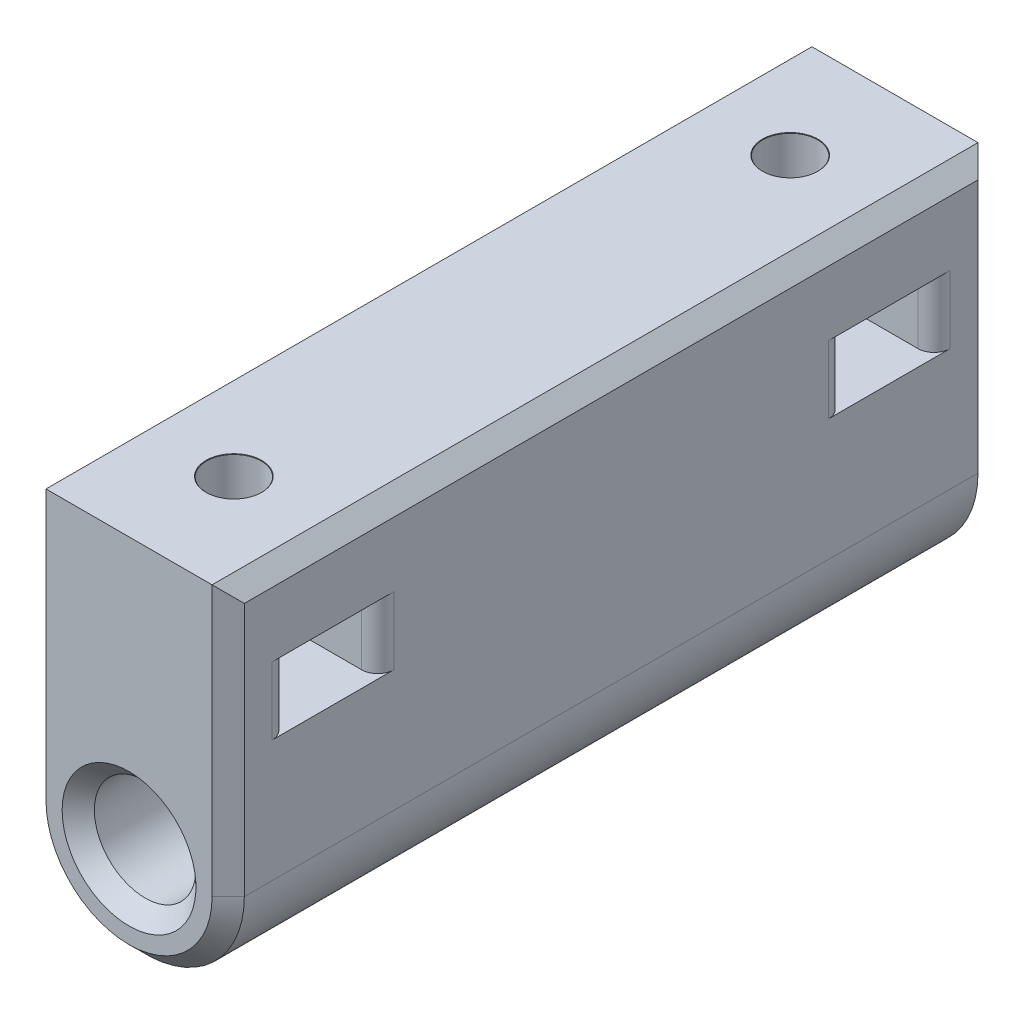
from build123d import *

# Parameters (mm, degrees)
SKETCH1_R           = 3.15
BOSS_EXTRUDE1_DEPTH = 47.5
CUT_EXTRUDE1_DEPTH  = 4.2
FILLET1_R           = 1
CHAMFER1_SIZE       = 1
CHAMFER2_SIZE       = 1


with BuildPart() as part:
    # Sketch1 → Boss-Extrude1 (new body)
    with BuildSketch(Plane.XY):
        with BuildLine():
            Line((6.15, 0), (6.15, 16.75))
            Line((6.15, 16.75), (-6.15, 16.75))
            Line((-6.15, 16.75), (-6.15, 0))
            ThreePointArc((-6.15, 0), (0, -6.15), (6.15, 0))
        make_face()
        Circle(SKETCH1_R, mode=Mode.SUBTRACT)
    extrude(amount=BOSS_EXTRUDE1_DEPTH)

    # Sketch4 → Cut-Extrude1 (cut)
    with BuildSketch(Plane(origin=(0, 11.75, 0), x_dir=(1, 0, 0), z_dir=(0, 1, 0))):
        Polygon((-3.204293994, -41), (-1.602146997, -43.775), (1.602146997, -43.775), (6.15, -43.775), (6.15, -38.225), (1.602146997, -38.225), (-1.602146997, -38.225), align=None)
    cut_extrude1 = extrude(amount=-CUT_EXTRUDE1_DEPTH, mode=Mode.SUBTRACT)

    # Sketch7 → M3 Clearance Hole1 (revolve, cut)
    with BuildSketch(Plane(origin=(0, 16.75, 41), x_dir=(0, 0, 1), z_dir=(1, 0, 0))):
        Polygon((0, 0), (0, 17.770463052), (1.7, 16.749), (1.7, 0.025), (1.725, 0), align=None)
    m3_clearance_hole1 = revolve(axis=Axis((0, 23.1, 41), (0, -1, 0)), mode=Mode.SUBTRACT)

    # Mirror1: Cut-Extrude1, M3 Clearance Hole1 across plane
    add(cut_extrude1.mirror(Plane(origin=(0, 0, 23.75), x_dir=(1, 0, 0), z_dir=(0, 0, -1))), mode=Mode.SUBTRACT)
    add(m3_clearance_hole1.mirror(Plane(origin=(0, 0, 23.75), x_dir=(1, 0, 0), z_dir=(0, 0, -1))), mode=Mode.SUBTRACT)

    # Fillet1
    fillet1_edges = [part.edges().sort_by_distance(p)[0] for p in [
        (6.15, 9.65, 38.225),
        (6.15, 9.65, 43.775),
        (6.15, 9.65, 3.725),
        (6.15, 9.65, 9.275),
    ]]
    fillet(fillet1_edges, radius=FILLET1_R)

    # Chamfer1
    chamfer1_edges = [part.edges().sort_by_distance(p)[0] for p in [
        (-6.15, 8.375, 47.5),
        (0, -6.15, 47.5),
        (-6.15, 8.375, 0),
        (6.15, 8.375, 0),
        (0, -6.15, 0),
        (-6.15, 16.75, 23.75),
        (6.15, 16.75, 23.75),
        (6.15, 8.375, 47.5),
    ]]
    chamfer(chamfer1_edges, length=CHAMFER1_SIZE)

    # Chamfer2
    chamfer2_edges = [part.edges().sort_by_distance(p)[0] for p in [
        (-3.15, 0, 0),
        (-3.15, 0, 47.5),
    ]]
    chamfer(chamfer2_edges, length=CHAMFER2_SIZE)


solid = part.part
